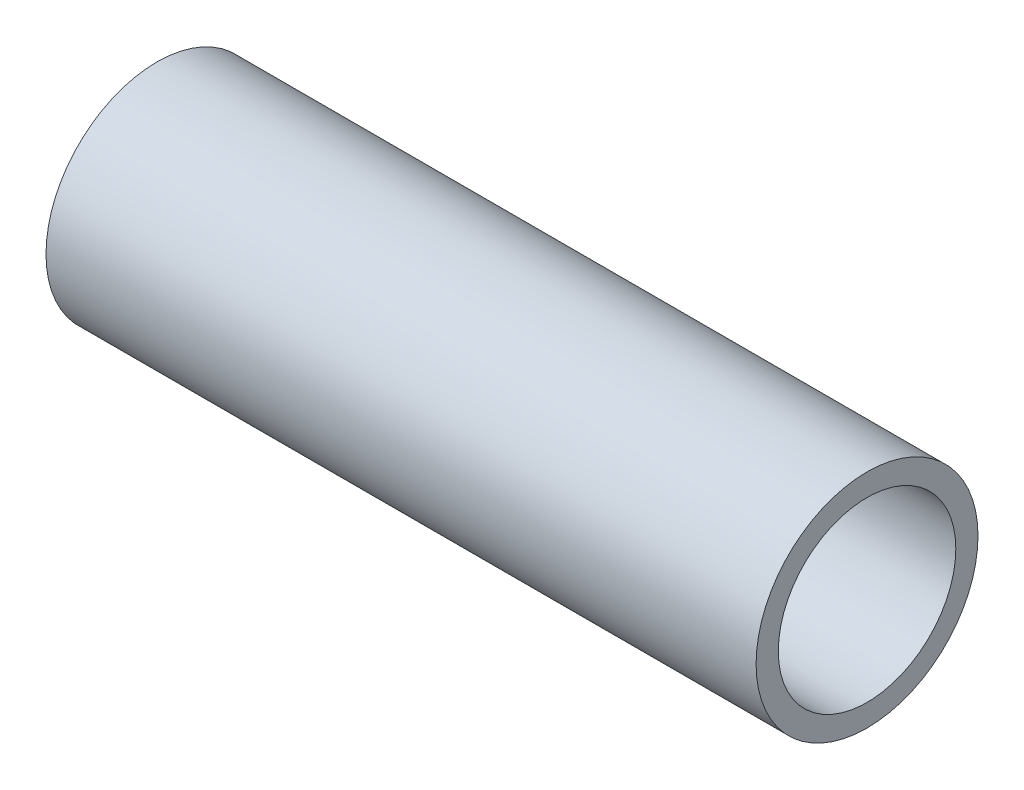
from build123d import *

# Parameters (mm, degrees)
SKETCH1_R      = 15.875
SKETCH1_R_2    = 12.7
EXTRUDE1_DEPTH = 50.8


with BuildPart() as part:
    # Sketch1 → Extrude1 (new, symmetric)
    with BuildSketch(Plane(origin=(0, 0, 0), x_dir=(0, 0, -1), z_dir=(1, 0, 0))):
        Circle(SKETCH1_R)
        Circle(SKETCH1_R_2, mode=Mode.SUBTRACT)
    extrude(amount=EXTRUDE1_DEPTH, both=True)


solid = part.part
